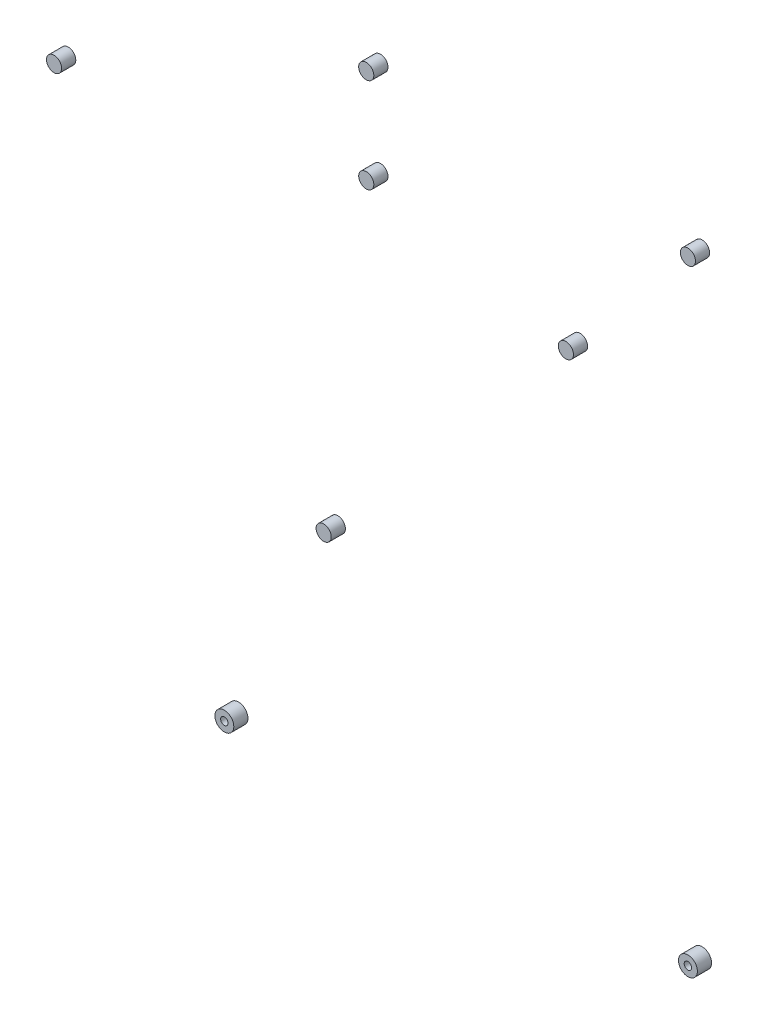
from build123d import *

# Parameters (mm, degrees)
SKETCH1_R             = 2.54
SKETCH1_R_2           = 1
BOSS_EXTRUDE1_DEPTH   = 3.81
BOSS_EXTRUDE1_2_DEPTH = 3.81
SKETCH1_R_3           = 2.032
BOSS_EXTRUDE1_3_DEPTH = 3.81
BOSS_EXTRUDE1_4_DEPTH = 3.81
BOSS_EXTRUDE1_5_DEPTH = 3.81
BOSS_EXTRUDE1_6_DEPTH = 3.81
BOSS_EXTRUDE1_7_DEPTH = 3.81
BOSS_EXTRUDE1_8_DEPTH = 3.81


with BuildPart() as part:
    # Sketch1 → Boss-Extrude1 (new body)
    with BuildSketch(Plane.XY):
        with Locations(Location((96.52, -79.756, 0), (0, 0, 180))):
            Circle(SKETCH1_R)
        with Locations(Location((96.52, -79.756, 0), (0, 0, 180))):
            Circle(SKETCH1_R_2, mode=Mode.SUBTRACT)
    extrude(amount=BOSS_EXTRUDE1_DEPTH)


with BuildPart() as body_2:
    # Sketch1 → Boss-Extrude1 2 (new body)
    with BuildSketch(Plane.XY):
        with Locations(Location((-27.94, -85.09, 0), (0, 0, 180))):
            Circle(SKETCH1_R)
        with Locations(Location((-27.94, -85.09, 0), (0, 0, 180))):
            Circle(SKETCH1_R_2, mode=Mode.SUBTRACT)
    extrude(amount=BOSS_EXTRUDE1_2_DEPTH)


with BuildPart() as body_3:
    # Sketch1 → Boss-Extrude1 3 (new body)
    with BuildSketch(Plane.XY):
        with Locations(Location((-1.27, -27.94, 0), (0, 0, 180))):
            Circle(SKETCH1_R_3)
    extrude(amount=BOSS_EXTRUDE1_3_DEPTH)


with BuildPart() as body_4:
    # Sketch1 → Boss-Extrude1 4 (new body)
    with BuildSketch(Plane.XY):
        with Locations(Location((63.754, 46.99, 0), (0, 0, 180))):
            Circle(SKETCH1_R_3)
    extrude(amount=BOSS_EXTRUDE1_4_DEPTH)


with BuildPart() as body_5:
    # Sketch1 → Boss-Extrude1 5 (new body)
    with BuildSketch(Plane.XY):
        with Locations(Location((10.16, 59.69, 0), (0, 0, 180))):
            Circle(SKETCH1_R_3)
    extrude(amount=BOSS_EXTRUDE1_5_DEPTH)


with BuildPart() as body_6:
    # Sketch1 → Boss-Extrude1 6 (new body)
    with BuildSketch(Plane.XY):
        with Locations(Location((10.16, 85.09, 0), (0, 0, 180))):
            Circle(SKETCH1_R_3)
    extrude(amount=BOSS_EXTRUDE1_6_DEPTH)


with BuildPart() as body_7:
    # Sketch1 → Boss-Extrude1 7 (new body)
    with BuildSketch(Plane.XY):
        with Locations(Location((96.52, 85.09, 0), (0, 0, 180))):
            Circle(SKETCH1_R_3)
    extrude(amount=BOSS_EXTRUDE1_7_DEPTH)


with BuildPart() as body_8:
    # Sketch1 → Boss-Extrude1 8 (new body)
    with BuildSketch(Plane.XY):
        with Locations(Location((-73.66, 44.831, 0), (0, 0, 180))):
            Circle(SKETCH1_R_3)
    extrude(amount=BOSS_EXTRUDE1_8_DEPTH)


solid = Compound([part.part, body_2.part, body_3.part, body_4.part, body_5.part, body_6.part, body_7.part, body_8.part])
